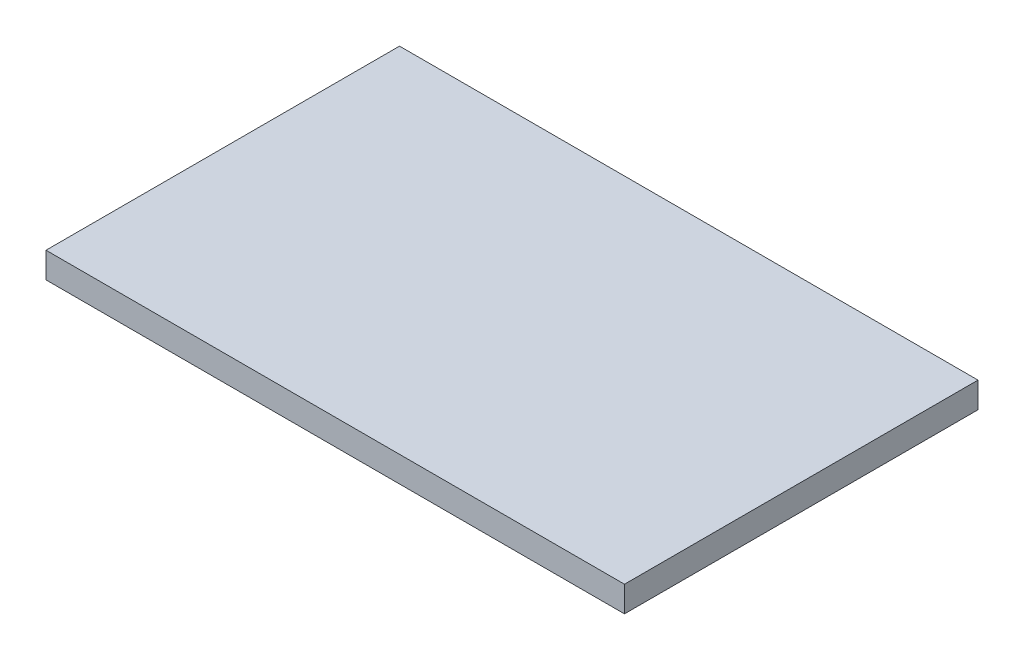
from build123d import *

# Parameters (mm, degrees)
SKETCH_1_W      = 90
SKETCH_1_H      = 55
EXTRUDE_1_DEPTH = 4


with BuildPart() as part:
    # Эскиз1 → Бобышка-Вытянуть1 (new body)
    with BuildSketch(Plane(origin=(0, 0, 0), x_dir=(1, 0, 0), z_dir=(0, 1, 0))):
        Rectangle(SKETCH_1_W, SKETCH_1_H)
    extrude(amount=EXTRUDE_1_DEPTH)


solid = part.part
